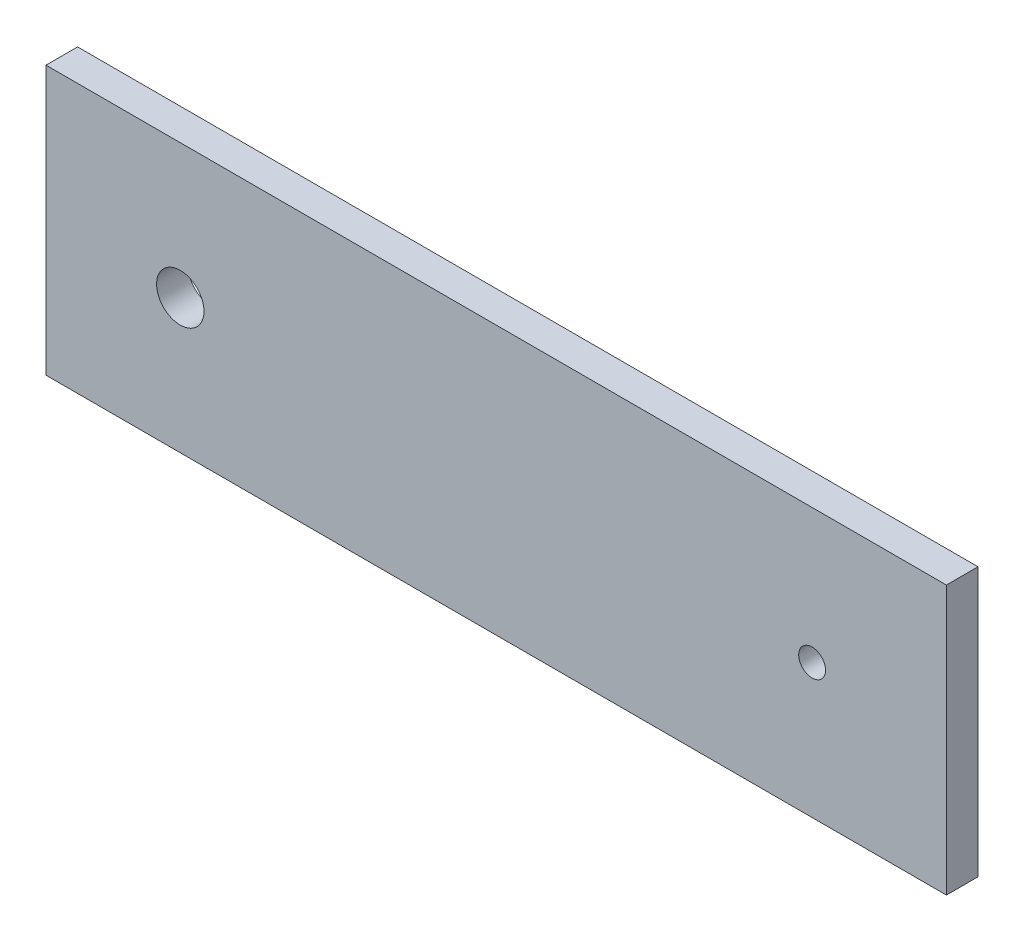
from build123d import *

# Parameters (mm, degrees)
SKETCH_1_W      = 114
SKETCH_1_H      = 34
SKETCH_1_R      = 3
SKETCH_1_R_2    = 1.7
EXTRUDE_1_DEPTH = 2


with BuildPart() as part:
    # 草图1 → 凸台-拉伸1 (new, symmetric)
    with BuildSketch(Plane.XY):
        with Locations((40, 0)):
            Rectangle(SKETCH_1_W, SKETCH_1_H)
        Circle(SKETCH_1_R, mode=Mode.SUBTRACT)
        with Locations((80, 0)):
            Circle(SKETCH_1_R_2, mode=Mode.SUBTRACT)
    extrude(amount=EXTRUDE_1_DEPTH, both=True)


solid = part.part
